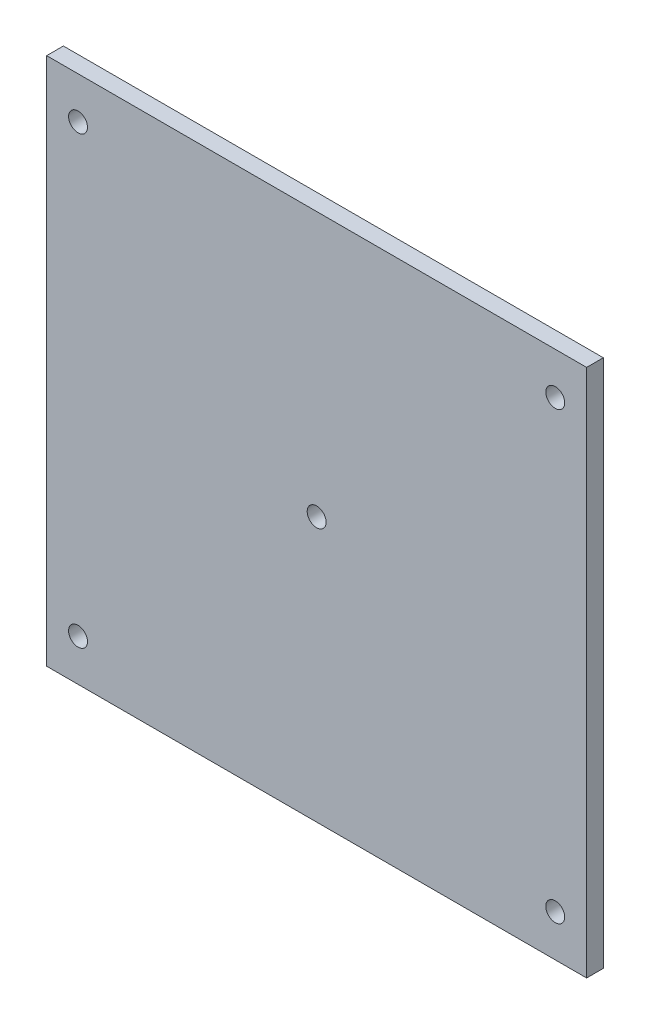
from build123d import *

# Parameters (mm, degrees)
BODY_SKETCH_W    = 97
BODY_SKETCH_H    = 95
BODY_DEPTH       = 3
HOLES_DEPTH      = 136.805007271
HOLES_DEPTH_BACK = 136.805007271
HOLES_SKETCH_R   = 1.7


with BuildPart() as part:
    # Body sketch → Body (new body)
    with BuildSketch(Plane.XY):
        with Locations((48.5, 47.5)):
            Rectangle(BODY_SKETCH_W, BODY_SKETCH_H)
    extrude(amount=BODY_DEPTH)

    # Holes sketch → Holes (cut, two sides: drawn at the far end of the back side and taken through both)
    with BuildSketch(Plane.XY.offset(-HOLES_DEPTH_BACK)):
        with Locations((5.635, 7.495)):
            Circle(HOLES_SKETCH_R)
        with Locations((91.365, 7.495)):
            Circle(HOLES_SKETCH_R)
        with Locations((5.635, 87.505)):
            Circle(HOLES_SKETCH_R)
        with Locations((91.365, 87.505)):
            Circle(HOLES_SKETCH_R)
        with Locations((48.5, 47.5)):
            Circle(HOLES_SKETCH_R)
    extrude(amount=HOLES_DEPTH + HOLES_DEPTH_BACK, mode=Mode.SUBTRACT)


solid = part.part
